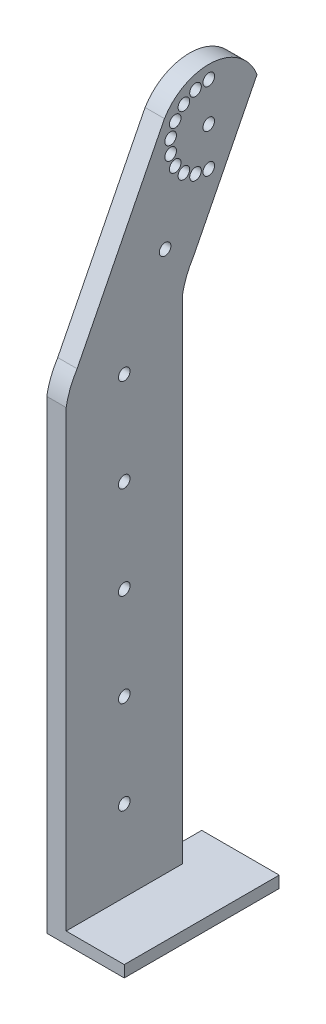
from build123d import *

# Parameters (mm, degrees)
SKETCH_1_R          = 1.5
EXTRUDE_2_DEPTH     = 5
CUT_EXTRUDE_2_DEPTH = 1
SKETCH_4_W          = 20
SKETCH_4_H          = 40
EXTRUDE_3_DEPTH     = 3


with BuildPart() as part:
    # 草图1 → 凸台-拉伸2 (new body)
    with BuildSketch(Plane(origin=(0, 0, 0), x_dir=(0, 0, -1), z_dir=(1, 0, 0))):
        with BuildLine():
            Line((-15, 0), (15, 0))
            Line((15, 0), (15, 130))
            ThreePointArc((15, 130), (16.060667235, 133.763397528), (17.833287426, 137.248507798))
            Line((17.833287426, 137.248507798), (34.277601095, 169.80605943))
            ThreePointArc((34.277601095, 169.80605943), (22.969406924, 178.256928012), (10.37531975, 171.878730504))
            Line((10.37531975, 171.878730504), (-12.166712574, 127.248507798))
            ThreePointArc((-12.166712574, 127.248507798), (-13.939332765, 123.763397528), (-15, 120))
            Line((-15, 120), (-15, 0))
        make_face()
        with Locations((0, 23.934052351)):
            Circle(SKETCH_1_R, mode=Mode.SUBTRACT)
        with Locations((0, 47.934052351)):
            Circle(SKETCH_1_R, mode=Mode.SUBTRACT)
        with Locations((0, 71.934052351)):
            Circle(SKETCH_1_R, mode=Mode.SUBTRACT)
        with Locations((0, 95.934052351)):
            Circle(SKETCH_1_R, mode=Mode.SUBTRACT)
        with Locations((10.541707006, 142.602806473)):
            Circle(SKETCH_1_R, mode=Mode.SUBTRACT)
        with Locations((0, 119.934052351)):
            Circle(SKETCH_1_R, mode=Mode.SUBTRACT)
        with Locations((21.812723168, 164.917917825)):
            Circle(SKETCH_1_R, mode=Mode.SUBTRACT)
        with Locations((11.964645637, 166.654399602)):
            Circle(SKETCH_1_R, mode=Mode.SUBTRACT)
        with Locations((11.964645637, 163.181436049)):
            Circle(SKETCH_1_R, mode=Mode.SUBTRACT)
        with Locations((13.15246913, 159.917917825)):
            Circle(SKETCH_1_R, mode=Mode.SUBTRACT)
        with Locations((15.384847071, 157.257473394)):
            Circle(SKETCH_1_R, mode=Mode.SUBTRACT)
        with Locations((21.812723168, 154.917917825)):
            Circle(SKETCH_1_R, mode=Mode.SUBTRACT)
        with Locations((18.392521734, 155.520991617)):
            Circle(SKETCH_1_R, mode=Mode.SUBTRACT)
        with Locations((13.15246913, 169.917917825)):
            Circle(SKETCH_1_R, mode=Mode.SUBTRACT)
        with Locations((15.384847071, 172.578362256)):
            Circle(SKETCH_1_R, mode=Mode.SUBTRACT)
        with Locations((18.392521734, 174.314844033)):
            Circle(SKETCH_1_R, mode=Mode.SUBTRACT)
        with Locations((21.812723168, 174.917917825)):
            Circle(SKETCH_1_R, mode=Mode.SUBTRACT)
    extrude(amount=-EXTRUDE_2_DEPTH)

    # 草图3 → 切除-拉伸2 (cut)
    with BuildSketch(Plane.ZY.offset(5)):
        with BuildLine():
            Line((-10, 5), (10, 5))
            Line((10, 5), (10, 119.524724411))
            ThreePointArc((10, 119.524724411), (9.161705076, 122.242477333), (7.82549521, 124.753147068))
            Line((7.82549521, 124.753147068), (-14.73885303, 169.427552317))
            ThreePointArc((-14.73885303, 169.427552317), (-21.607154469, 173.304465594), (-28.657153069, 169.768713769))
            Line((-28.657153069, 169.768713769), (-13.477541954, 139.715104809))
            ThreePointArc((-13.477541954, 139.715104809), (-11.272736422, 135.241025308), (-10, 130.418298195))
            Line((-10, 130.418298195), (-10, 5))
        make_face()
    extrude(amount=-CUT_EXTRUDE_2_DEPTH, mode=Mode.SUBTRACT)

    # 草图4 → 凸台-拉伸3 (add)
    with BuildSketch(Plane(origin=(0, 0, 0), x_dir=(-1, 0, 0), z_dir=(0, -1, 0))):
        with Locations((-5, 5)):
            Rectangle(SKETCH_4_W, SKETCH_4_H)
    extrude(amount=-EXTRUDE_3_DEPTH)


solid = part.part
